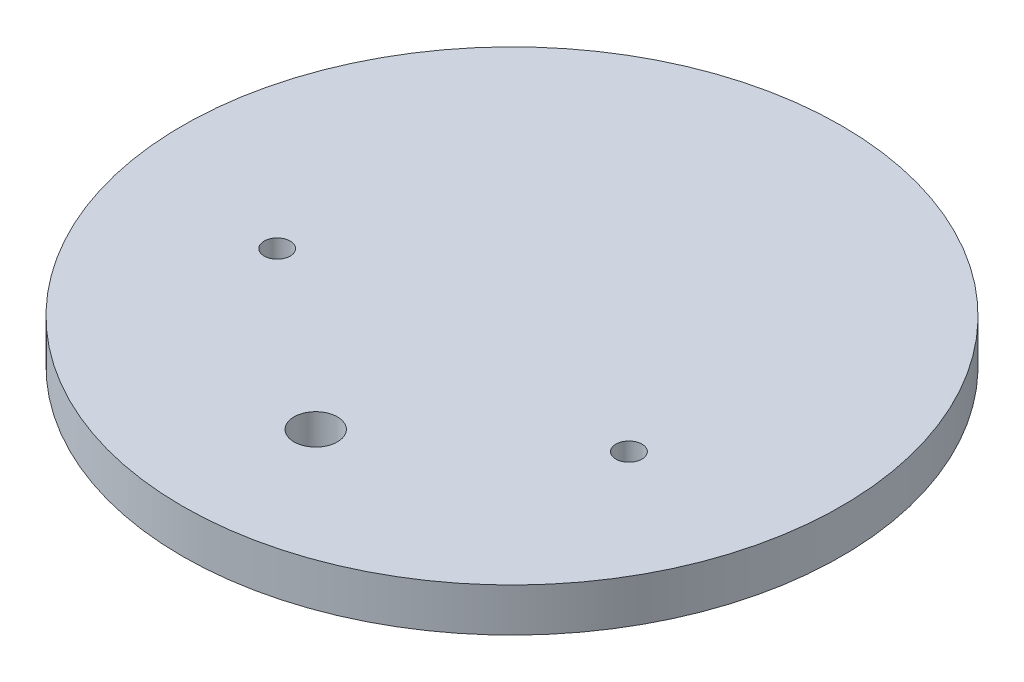
from build123d import *

# Parameters (mm, degrees)
SKETCH1_R           = 37.95
SKETCH1_R_2         = 1.5
SKETCH1_R_3         = 2.5
BOSS_EXTRUDE1_DEPTH = 5


with BuildPart() as part:
    # Sketch1 → Boss-Extrude1 (new body)
    with BuildSketch(Plane(origin=(0, 0, 0), x_dir=(1, 0, 0), z_dir=(0, 1, 0))):
        with Locations(Location((0, 0, 0), (0, 0, 270))):
            Circle(SKETCH1_R)
        with Locations(Location((-20.238106424, -6.798656962, 0), (0, 0, 270))):
            Circle(SKETCH1_R_2, mode=Mode.SUBTRACT)
        with Locations(Location((20.261893576, -6.798656962, 0), (0, 0, 270))):
            Circle(SKETCH1_R_2, mode=Mode.SUBTRACT)
        with Locations(Location((0.011893576, -22.616220732, 0), (0, 0, 270))):
            Circle(SKETCH1_R_3, mode=Mode.SUBTRACT)
    extrude(amount=BOSS_EXTRUDE1_DEPTH)


solid = part.part
